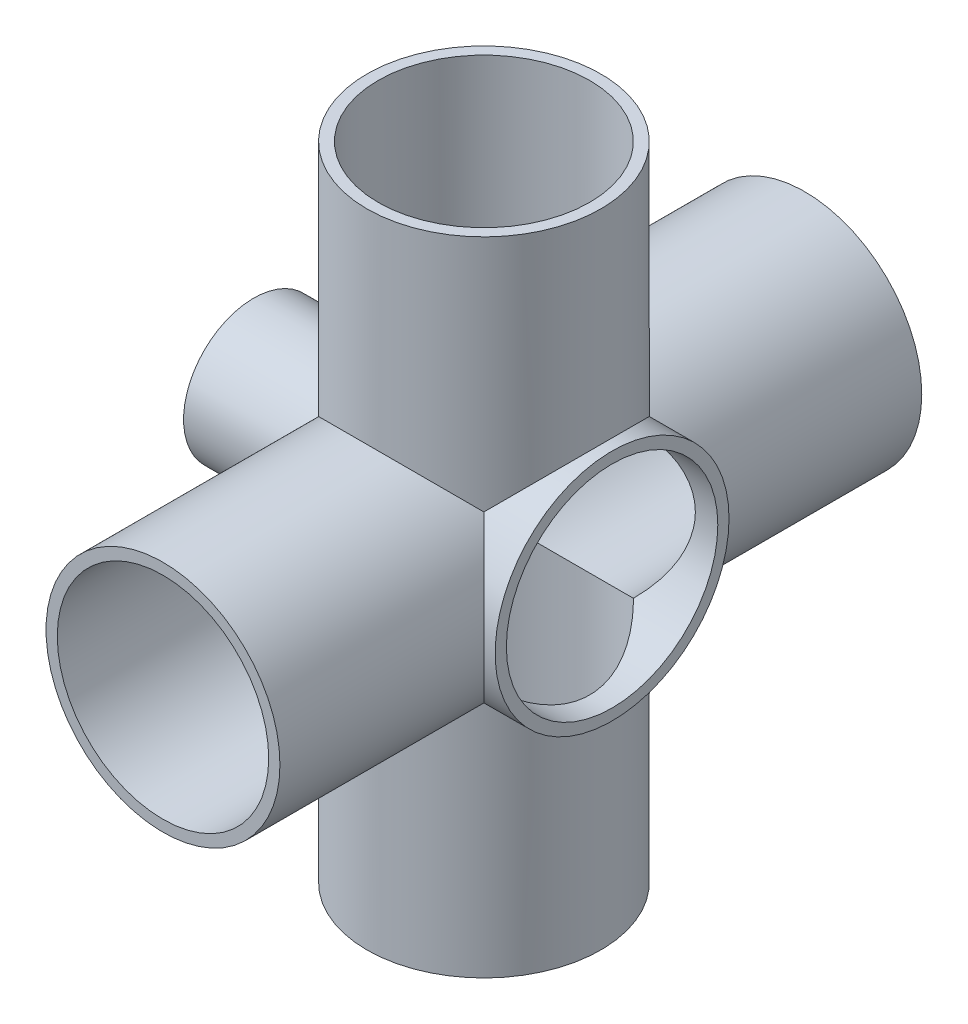
from build123d import *

# Parameters (mm, degrees)
EXTRUDE3_DEPTH          = 87.122
EXTRUDE3_DEPTH_BACK     = 87.122
SKETCH1_R               = 31.75
EXTRUDE4_DEPTH          = 87.122
EXTRUDE4_DEPTH_BACK     = 87.122
SKETCH4_R               = 31.75
SKETCH6_R               = 31.75
EXTRUDE5_DEPTH          = 34.798
SKETCH7_R               = 19.05
EXTRUDE6_DEPTH          = 62.484
CUT_EXTRUDE1_DEPTH      = 139.147515618
CUT_EXTRUDE1_DEPTH_BACK = 139.147515618
SKETCH9_R               = 28.702
CUT_EXTRUDE2_DEPTH      = 139.147515618
CUT_EXTRUDE2_DEPTH_BACK = 139.147515618
SKETCH10_R              = 28.702
SKETCH11_R              = 28.702
CUT_EXTRUDE3_DEPTH      = 139.147515618
SKETCH12_R              = 17.399
CUT_EXTRUDE4_DEPTH      = 139.147515618


with BuildPart() as part:
    # Sketch1 → Extrude3 (new, two sides: drawn at the far end of the back side and taken through both)
    with BuildSketch(Plane(origin=(0, 0, 0), x_dir=(1, 0, 0), z_dir=(0, 1, 0)).offset(-EXTRUDE3_DEPTH_BACK)):
        Circle(SKETCH1_R)
    extrude(amount=EXTRUDE3_DEPTH + EXTRUDE3_DEPTH_BACK)

    # Sketch4 → Extrude4 (add, two sides: drawn at the far end of the back side and taken through both)
    with BuildSketch(Plane.XY.offset(-EXTRUDE4_DEPTH_BACK)):
        Circle(SKETCH4_R)
    extrude(amount=EXTRUDE4_DEPTH + EXTRUDE4_DEPTH_BACK)

    # Sketch6 → Extrude5 (add)
    with BuildSketch(Plane(origin=(0, 0, 0), x_dir=(0, 0, -1), z_dir=(1, 0, 0))):
        Circle(SKETCH6_R)
    extrude(amount=EXTRUDE5_DEPTH)

    # Sketch7 → Extrude6 (add)
    with BuildSketch(Plane(origin=(0, 0, 0), x_dir=(0, 0, -1), z_dir=(1, 0, 0))):
        Circle(SKETCH7_R)
    extrude(amount=-EXTRUDE6_DEPTH)

    # Sketch9 → Cut-Extrude1 (cut, two sides: drawn at the far end of the back side and taken through both)
    with BuildSketch(Plane(origin=(0, 0, 0), x_dir=(1, 0, 0), z_dir=(0, 1, 0)).offset(-CUT_EXTRUDE1_DEPTH_BACK)):
        Circle(SKETCH9_R)
    extrude(amount=CUT_EXTRUDE1_DEPTH + CUT_EXTRUDE1_DEPTH_BACK, mode=Mode.SUBTRACT)

    # Sketch10 → Cut-Extrude2 (cut, two sides: drawn at the far end of the back side and taken through both)
    with BuildSketch(Plane.XY.offset(-CUT_EXTRUDE2_DEPTH_BACK)):
        Circle(SKETCH10_R)
    extrude(amount=CUT_EXTRUDE2_DEPTH + CUT_EXTRUDE2_DEPTH_BACK, mode=Mode.SUBTRACT)

    # Sketch11 → Cut-Extrude3 (cut, through all)
    with BuildSketch(Plane(origin=(0, 0, 0), x_dir=(0, 0, -1), z_dir=(1, 0, 0))):
        Circle(SKETCH11_R)
    extrude(amount=CUT_EXTRUDE3_DEPTH, mode=Mode.SUBTRACT)

    # Sketch12 → Cut-Extrude4 (cut, through all)
    with BuildSketch(Plane(origin=(0, 0, 0), x_dir=(0, 0, -1), z_dir=(1, 0, 0))):
        Circle(SKETCH12_R)
    extrude(amount=-CUT_EXTRUDE4_DEPTH, mode=Mode.SUBTRACT)


solid = part.part
